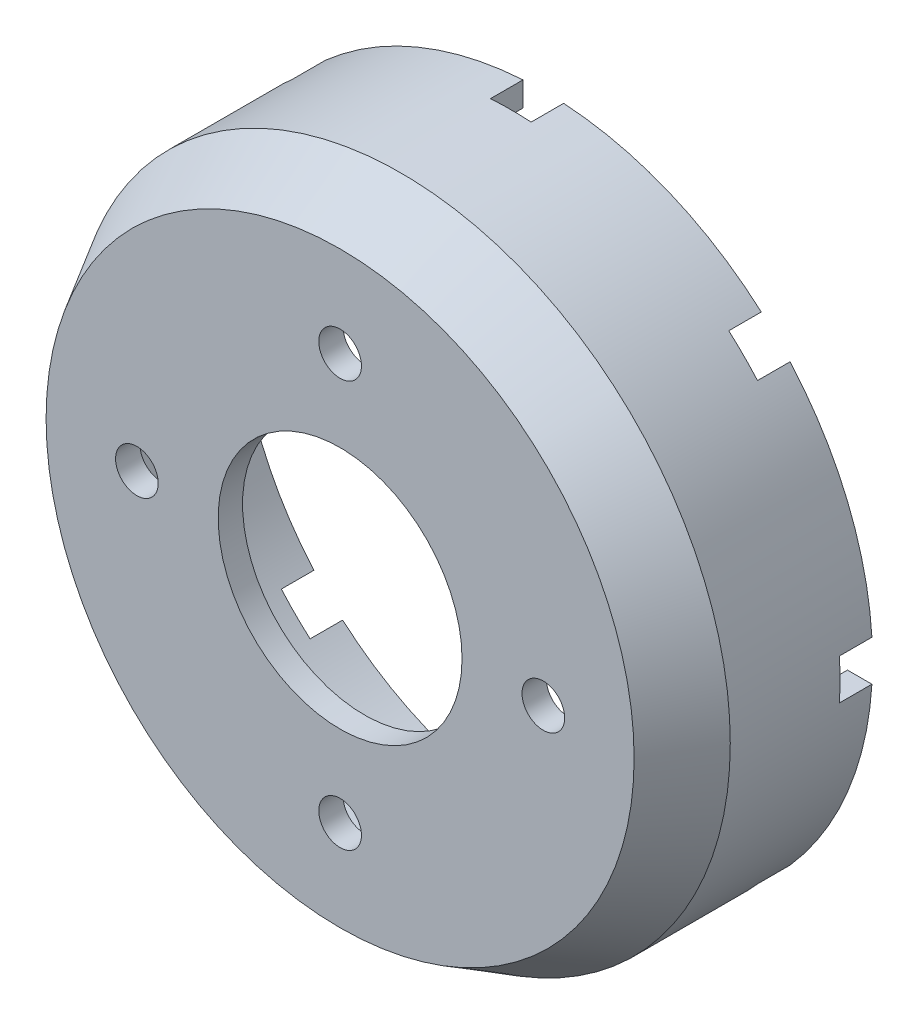
from build123d import *

# Parameters (mm, degrees)
SZKIC1_R                    = 81
DODANIE_WYCI_GNI_CIE1_DEPTH = 50
SKORUPA1_T                  = -6
WYTNIJ_WYCI_GNI_CIE1_DEPTH  = 8
SZYK_KO_OWY1_COUNT          = 8
SZKIC5_R                    = 30
SZKIC5_R_2                  = 5.25
WYTNIJ_WYCI_GNI_CIE2_DEPTH  = 6
SZKIC6_R                    = 1.5
WYTNIJ_WYCI_GNI_CIE3_DEPTH  = 10
SZYK_KO_OWY2_COUNT          = 8
SFAZOWANIE1_SIZE            = 15
SFAZOWANIE1_SIZE2           = 8.660254038
SFAZOWANIE2_SIZE            = 15
SFAZOWANIE2_SIZE2           = 8.660254038


with BuildPart() as part:
    # Szkic1 → Dodanie-wyciągnięcie1 (new body)
    with BuildSketch(Plane.XY):
        Circle(SZKIC1_R)
    extrude(amount=DODANIE_WYCI_GNI_CIE1_DEPTH)

    # Skorupa1
    skorupa1_openings = [part.faces().sort_by_distance(p)[0] for p in [
        (0, 0, 0),
    ]]
    offset(amount=SKORUPA1_T, openings=skorupa1_openings, kind=Kind.INTERSECTION)

    # Szkic2 → Wytnij-wyciągnięcie1 (cut)
    with BuildSketch(Plane(origin=(0, 0, 0), x_dir=(-1, 0, 0), z_dir=(0, 0, -1))):
        with BuildLine():
            Line((5, 69.821200219), (5, 85.854528128))
            ThreePointArc((5, 85.854528128), (0, 86), (-5, 85.854528128))
            Line((-5, 85.854528128), (-5, 69.821200219))
            ThreePointArc((-5, 69.821200219), (0, 70), (5, 69.821200219))
        make_face()
    wytnij_wyci_gni_cie1 = extrude(amount=-WYTNIJ_WYCI_GNI_CIE1_DEPTH, mode=Mode.SUBTRACT)

    # Szyk kołowy1: Wytnij-wyciągnięcie1 ×8 about axis
    szyk_ko_owy1_axis = Axis((0, 0, 0), (0, 0, 1))
    for i in range(1, SZYK_KO_OWY1_COUNT):
        add(wytnij_wyci_gni_cie1.rotate(szyk_ko_owy1_axis, i * 360 / SZYK_KO_OWY1_COUNT), mode=Mode.SUBTRACT)

    # Szkic5 → Wytnij-wyciągnięcie2 (cut)
    with BuildSketch(Plane.XY.offset(50)):
        Circle(SZKIC5_R)
        with Locations((0, 50)):
            Circle(SZKIC5_R_2)
        with Locations((50, 0)):
            Circle(SZKIC5_R_2)
        with Locations((0, -50)):
            Circle(SZKIC5_R_2)
        with Locations((-50, 0)):
            Circle(SZKIC5_R_2)
    extrude(amount=-WYTNIJ_WYCI_GNI_CIE2_DEPTH, mode=Mode.SUBTRACT)

    # Szkic6 → Wytnij-wyciągnięcie3 (cut)
    with BuildSketch(Plane(origin=(0, 0, 0), x_dir=(-1, 0, 0), z_dir=(0, 0, -1))):
        with Locations((-29.849307724, 72.062603536)):
            Circle(SZKIC6_R)
    wytnij_wyci_gni_cie3 = extrude(amount=-WYTNIJ_WYCI_GNI_CIE3_DEPTH, mode=Mode.SUBTRACT)

    # Szyk kołowy2: Wytnij-wyciągnięcie3 ×8 about axis
    szyk_ko_owy2_axis = Axis((0, 0, 0), (0, 0, 1))
    for i in range(1, SZYK_KO_OWY2_COUNT):
        add(wytnij_wyci_gni_cie3.rotate(szyk_ko_owy2_axis, i * 360 / SZYK_KO_OWY2_COUNT), mode=Mode.SUBTRACT)

    # Sfazowanie1
    sfazowanie1_edges = [part.edges().sort_by_distance(p)[0] for p in [
        (-75, 0, 44),
    ]]
    sfazowanie1_side = [part.faces().sort_by_distance(p)[0] for p in [
        (-75, 0, 22),
    ]]
    chamfer(sfazowanie1_edges, length=SFAZOWANIE1_SIZE, length2=SFAZOWANIE1_SIZE2, reference=sfazowanie1_side[0])

    # Sfazowanie2
    sfazowanie2_edges = [part.edges().sort_by_distance(p)[0] for p in [
        (-81, 0, 50),
    ]]
    sfazowanie2_side = [part.faces().sort_by_distance(p)[0] for p in [
        (-81, 0, 25),
    ]]
    chamfer(sfazowanie2_edges, length=SFAZOWANIE2_SIZE, length2=SFAZOWANIE2_SIZE2, reference=sfazowanie2_side[0])


solid = part.part
